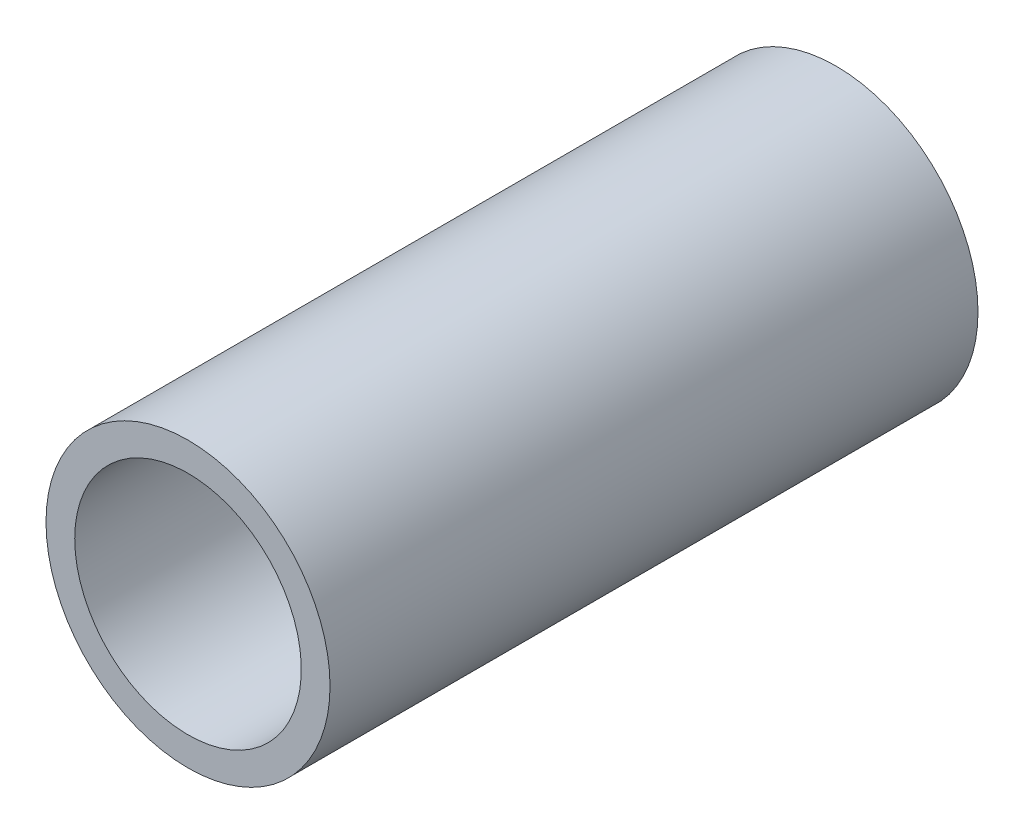
from build123d import *

# Parameters (mm, degrees)
SKETCH1_R           = 16.7005
SKETCH1_R_2         = 13.3223
EXTRUDE_THIN1_DEPTH = 38.1


with BuildPart() as part:
    # Sketch1 → Extrude-Thin1 (new, symmetric)
    with BuildSketch(Plane.XY):
        Circle(SKETCH1_R)
        Circle(SKETCH1_R_2, mode=Mode.SUBTRACT)
    extrude(amount=EXTRUDE_THIN1_DEPTH, both=True)


solid = part.part
